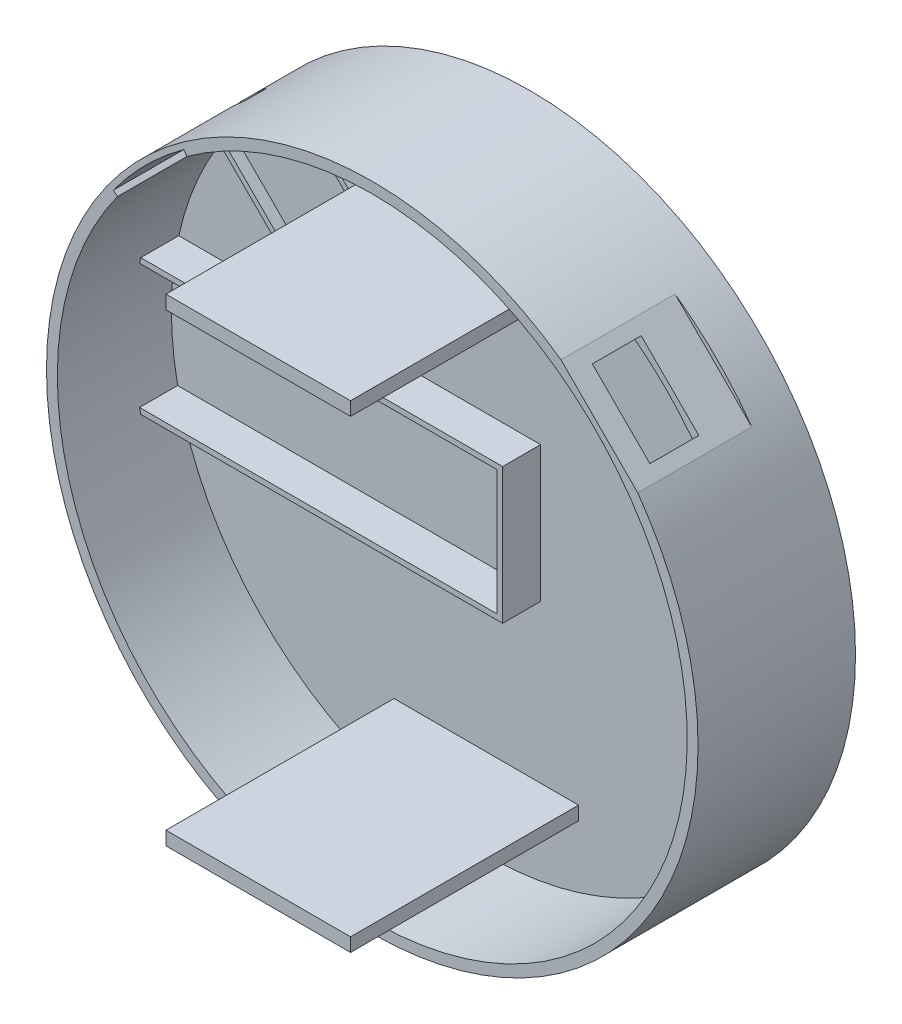
from build123d import *

# Parameters (mm, degrees)
CROQUIS1_R              = 60
SALIENTE_EXTRUIR1_DEPTH = 8
SALIENTE_EXTRUIR2_DEPTH = 7
CROQUIS3_R              = 60
CROQUIS3_R_2            = 58
SALIENTE_EXTRUIR3_DEPTH = 21
SALIENTE_EXTRUIR4_DEPTH = 2
CORTAR_EXTRUIR1_DEPTH   = 88.412813706
CORTAR_EXTRUIR2_START   = 1.5
CORTAR_EXTRUIR2_DEPTH   = 4
CORTAR_EXTRUIR3_DEPTH   = 88.412813706
CROQUIS9_W              = 9
CROQUIS9_H              = 15
CORTAR_EXTRUIR4_DEPTH   = 4
CROQUIS4_W              = 34
CROQUIS4_H              = 2.5
SALIENTE_EXTRUIR5_DEPTH = 42


with BuildPart() as part:
    # Croquis1 → Saliente-Extruir1 (new body)
    with BuildSketch(Plane.XY):
        Circle(CROQUIS1_R)
    extrude(amount=SALIENTE_EXTRUIR1_DEPTH)

    # Croquis2 → Saliente-Extruir2 (add)
    with BuildSketch(Plane.XY.offset(8)):
        Polygon((-56, 11.5), (9, 11.5), (9, -11.5), (-56, -11.5), (-57, -11.5), (-57, -12.5), (10, -12.5), (10, 12.5), (-57, 12.5), (-57, 11.5), align=None)
    extrude(amount=SALIENTE_EXTRUIR2_DEPTH)

    # Croquis3 → Saliente-Extruir3 (add)
    with BuildSketch(Plane.XY.offset(8)):
        Circle(CROQUIS3_R)
        with Locations(Location((0, 0, 0), (0, 0, 168.56384578))):
            Circle(CROQUIS3_R_2, mode=Mode.SUBTRACT)
    extrude(amount=SALIENTE_EXTRUIR3_DEPTH)

    # Croquis5 → Saliente-Extruir4 (add)
    with BuildSketch(Plane.XY.offset(8)):
        with BuildLine():
            Line((-19.984781547, 32.755130015), (-34.126917171, 46.897265639))
            ThreePointArc((-34.126917171, 46.897265639), (-41.012193309, 41.012193309), (-46.897265639, 34.126917171))
            Line((-46.897265639, 34.126917171), (-32.755130015, 19.984781547))
            Line((-32.755130015, 19.984781547), (-33.462236796, 19.277674766))
            Line((-33.462236796, 19.277674766), (-48.204317574, 34.019755543))
            ThreePointArc((-48.204317574, 34.019755543), (-41.71930009, 41.71930009), (-34.019755543, 48.204317574))
            Line((-34.019755543, 48.204317574), (-19.277674766, 33.462236796))
            Line((-19.277674766, 33.462236796), (-19.984781547, 32.755130015))
        make_face()
    extrude(amount=SALIENTE_EXTRUIR4_DEPTH)

    # Croquis6 → Cortar-Extruir1 (cut, through all)
    with BuildSketch(Plane.XY.offset(8)):
        with BuildLine():
            Line((-47.705839185, 34.715312294), (-46.897265639, 34.126917171))
            ThreePointArc((-46.897265639, 34.126917171), (-41.012193309, 41.012193309), (-34.126917171, 46.897265639))
            Line((-34.126917171, 46.897265639), (-34.715312294, 47.705839185))
            ThreePointArc((-34.715312294, 47.705839185), (-41.71930009, 41.71930009), (-47.705839185, 34.715312294))
        make_face()
    extrude(amount=CORTAR_EXTRUIR1_DEPTH, mode=Mode.SUBTRACT)

    # Croquis7 → Cortar-Extruir2 (cut)
    with BuildSketch(Plane.XY.offset(8).offset(CORTAR_EXTRUIR2_START)):
        Polygon((-35.355339059, 42.426406871), (-42.426406871, 49.497474683), (-49.497474683, 42.426406871), (-42.426406871, 35.355339059), align=None)
    extrude(amount=CORTAR_EXTRUIR2_DEPTH, mode=Mode.SUBTRACT)

    # Croquis8 → Cortar-Extruir3 (cut, through all)
    with BuildSketch(Plane.XY.offset(8)):
        with BuildLine():
            Line((48.904069139, 34.761933515), (34.761933515, 48.904069139))
            ThreePointArc((34.761933515, 48.904069139), (42.426406871, 42.426406871), (48.904069139, 34.761933515))
        make_face()
    extrude(amount=CORTAR_EXTRUIR3_DEPTH, mode=Mode.SUBTRACT)

    # Croquis9 → Cortar-Extruir4 (cut)
    with BuildSketch(Plane(origin=(41.833001327, 41.833001327, 0), x_dir=(0, 0, -1), z_dir=(0.7071067811865464, 0.7071067811865488, 0))):
        with Locations((-20.5, 0)):
            Rectangle(CROQUIS9_W, CROQUIS9_H)
    extrude(amount=-CORTAR_EXTRUIR4_DEPTH, mode=Mode.SUBTRACT)

    # Croquis4 → Saliente-Extruir5 (add)
    with BuildSketch(Plane.XY.offset(8)):
        with Locations((0, 42.75)):
            Rectangle(CROQUIS4_W, CROQUIS4_H)
        with Locations((0, -42.75)):
            Rectangle(CROQUIS4_W, CROQUIS4_H)
    extrude(amount=SALIENTE_EXTRUIR5_DEPTH)


solid = part.part
